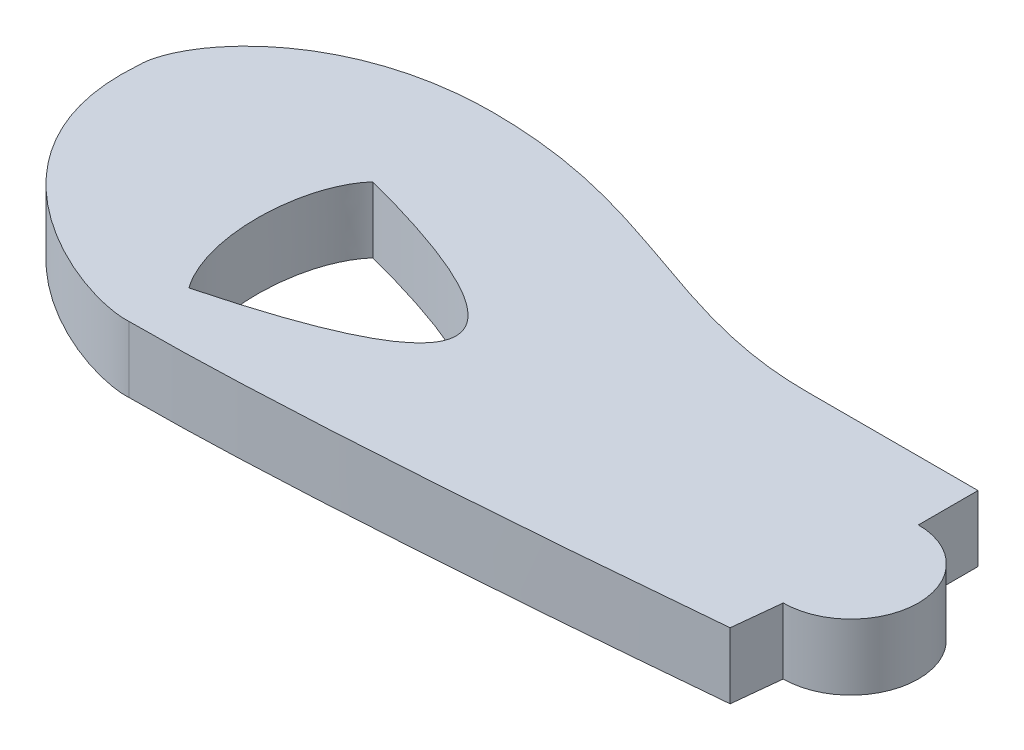
from build123d import *

# Parameters (mm, degrees)
BOSS_EXTRUDE1_DEPTH = 10
SKETCH5_W           = 190.665965361
SKETCH5_H           = 98.914857752
CUT_EXTRUDE2_DEPTH  = 131.512395512
CUT_EXTRUDE1_DEPTH  = 125.356356188


with BuildPart() as part:
    # Sketch2 → Boss-Extrude1 (new body)
    with BuildSketch(Plane(origin=(0, 0, 0), x_dir=(1, 0, 0), z_dir=(0, 1, 0))):
        with BuildLine():
            Line((-26, 24.3), (0, 24.3))
            add(Edge.make_bspline(
                [(0, 24.3), (20.683832289, 24.384713811), (29.8, 14.098961604), (29.8, 0)],
                knots=[0, 0, 0, 0, 1, 1, 1, 1], degree=3))
            add(Edge.make_bspline(
                [(29.8, 0), (29.8, -15.903385672), (12.793782652, -19.673675204), (0, -22.5)],
                knots=[0, 0, 0, 0, 1, 1, 1, 1], degree=3))
            add(Edge.make_bspline(
                [(-86.5, -27.9), (-58.742591927, -27.9), (0, -22.5)],
                knots=[0, 0, 0, 1, 1, 1], degree=2))
            add(Edge.make_bspline(
                [(-124.6, 11.6), (-126.645501882, -15.929564791), (-96.169164371, -28.458925346), (-86.5, -27.9)],
                knots=[0, 0, 0, 0, 1, 1, 1, 1], degree=3))
            add(Edge.make_bspline(
                [(-86.5, 37.2), (-111.583343569, 37.2), (-124.6, 21.145918181), (-124.6, 11.6)],
                knots=[0, 0, 0, 0, 1, 1, 1, 1], degree=3))
            add(Edge.make_bspline(
                [(-26, 24.3), (-46.37360759, 24.3), (-60.223367409, 37.2), (-86.5, 37.2)],
                knots=[0, 0, 0, 0, 1, 1, 1, 1], degree=3))
        make_face()
    extrude(amount=BOSS_EXTRUDE1_DEPTH)

    # Sketch5 → Cut-Extrude2 (cut, through all)
    with BuildSketch(Plane(origin=(0, 10, 0), x_dir=(1, 0, 0), z_dir=(0, 1, 0))):
        with Locations((-37.807166851, 5.712427693)):
            Rectangle(SKETCH5_W, SKETCH5_H)
        with BuildLine():
            Line((0, 19.3), (-26, 19.3))
            add(Edge.make_bspline(
                [(-26, 19.3), (-28.614389566, 19.3), (-31.195480065, 19.494126305), (-36.299918034, 20.219008193), (-38.823236595, 20.749932309), (-43.82844627, 22.053293526), (-46.31311575, 22.826190042), (-51.244397222, 24.470393512), (-53.69402913, 25.341112046), (-58.607069123, 27.040712597), (-61.070722849, 27.868848632), (-64.806301572, 28.989279687), (-66.059451522, 29.343006622), (-68.572193461, 29.996166113), (-69.832412317, 30.295833479), (-73.626302931, 31.102275727), (-76.173387066, 31.51524352), (-81.307214737, 32.063798503), (-83.893870441, 32.2), (-86.5, 32.2)],
                knots=[0, 0, 0, 0, 0.125, 0.125, 0.25, 0.25, 0.375, 0.375, 0.5, 0.5, 0.625, 0.625, 0.6875, 0.6875, 0.75, 0.75, 0.875, 0.875, 1, 1, 1, 1], degree=3))
            add(Edge.make_bspline(
                [(-86.5, 32.2), (-90.047671723, 32.2), (-93.539315109, 31.853363621), (-97.818101716, 30.88944061), (-98.669522164, 30.669824618), (-100.363040922, 30.17291839), (-101.207876089, 29.89460231), (-103.707194596, 28.9730152), (-105.314538731, 28.24898707), (-108.402461221, 26.564840966), (-109.885156962, 25.604040465), (-112.695415045, 23.412360835), (-113.989352092, 22.209304545), (-115.736354807, 20.217749989), (-116.286105675, 19.522480074), (-117.307591473, 18.056713662), (-117.771937921, 17.297113036), (-118.380597746, 16.112260348), (-118.568848857, 15.709499136), (-118.910400222, 14.885324985), (-119.063856456, 14.46298862), (-119.32099023, 13.612441675), (-119.425833719, 13.182501201), (-119.534502641, 12.528030347), (-119.56255262, 12.308265558), (-119.588853411, 11.975515189), (-119.594973106, 11.86407762), (-119.600932982, 11.639967141), (-119.6, 11.527142129), (-119.6, 11.414500659)],
                knots=[0, 0, 0, 0, 0.25, 0.25, 0.3125, 0.3125, 0.375, 0.375, 0.5, 0.5, 0.625, 0.625, 0.75, 0.75, 0.8125, 0.8125, 0.875, 0.875, 0.90625, 0.90625, 0.9375, 0.9375, 0.96875, 0.96875, 0.984375, 0.984375, 0.9921875, 0.9921875, 1, 1, 1, 1], degree=3))
            add(Edge.make_bspline(
                [(-119.6, 11.414500659), (-119.620469876, 11.139005048), (-119.640012507, 10.863585734), (-119.66949801, 10.313536999), (-119.702590259, 9.489380197), (-119.701746238, 8.668015761), (-119.653311171, 7.029133356), (-119.558725583, 5.941670929), (-119.316814989, 4.318708201), (-119.219497862, 3.779093122), (-118.990298597, 2.702707063), (-118.857842254, 2.164001324), (-118.411370332, 0.568296748), (-118.049576648, -0.466050211), (-117.204822005, -2.479103419), (-116.721870667, -3.457814087), (-115.911016092, -4.886192051), (-115.626316263, -5.355698602), (-115.028686616, -6.281748331), (-114.715117794, -6.739029825), (-113.098128241, -8.967198862), (-111.636582687, -10.586754888), (-109.243370012, -12.821144966), (-108.411754958, -13.533067597), (-107.116844881, -14.554870601), (-106.676456633, -14.888333255), (-105.787025552, -15.535321816), (-105.337421344, -15.84934205), (-103.066112758, -17.374312871), (-101.175798147, -18.452299517), (-98.237583629, -19.870168351), (-97.240844592, -20.309198302), (-95.209999189, -21.114841784), (-94.174615133, -21.48224539), (-92.064314636, -22.126795927), (-91.001033475, -22.402007075), (-89.387886633, -22.70933152), (-88.84713932, -22.794224632), (-88.028751145, -22.879499568), (-87.754740398, -22.90089357), (-87.340882626, -22.916536257), (-87.202453029, -22.918989427), (-86.924204685, -22.915854968), (-86.784006393, -22.908070411), (-86.64375233, -22.899963035)],
                knots=[0, 0, 0, 0, 0.015625, 0.015625, 0.03125, 0.0625, 0.0625, 0.125, 0.125, 0.15625, 0.15625, 0.1875, 0.1875, 0.25, 0.25, 0.3125, 0.3125, 0.34375, 0.34375, 0.375, 0.375, 0.5, 0.5, 0.5625, 0.5625, 0.59375, 0.59375, 0.625, 0.625, 0.75, 0.75, 0.8125, 0.8125, 0.875, 0.875, 0.9375, 0.9375, 0.96875, 0.96875, 0.984375, 0.984375, 0.9921875, 0.9921875, 1, 1, 1, 1], degree=3))
            add(Edge.make_bspline(
                [(-86.64375233, -22.899963035), (-83.051721737, -22.901813131), (-79.463866007, -22.836654879), (-72.292852573, -22.630933055), (-68.709770334, -22.489158228), (-57.965349536, -21.986375675), (-50.808741052, -21.549448214), (-36.50252062, -20.563295893), (-29.353030187, -20.012120654), (-15.058799553, -18.833526914), (-7.914092044, -18.205583695), (-0.771119947, -17.549786375)],
                knots=[0, 0, 0, 0, 0.125, 0.125, 0.25, 0.25, 0.5, 0.5, 0.75, 0.75, 1, 1, 1, 1], degree=3))
            add(Edge.make_bspline(
                [(-0.771119947, -17.549786375), (1.963321139, -16.94544861), (4.695341149, -16.33357579), (8.730024902, -15.218615637), (10.064478195, -14.814466089), (12.699729823, -13.90142355), (14.000796007, -13.393364173), (15.911888282, -12.505206219), (16.542091865, -12.187905528), (17.784402153, -11.496981701), (18.391917697, -11.125662576), (19.559410174, -10.32463286), (20.121164342, -9.894098151), (20.920538613, -9.18924898), (21.180682911, -8.943393186), (21.678462153, -8.434660622), (21.916135354, -8.171907904), (22.59259098, -7.356311131), (22.994745994, -6.776081028), (23.513123046, -5.842290056), (23.671822244, -5.519779327), (23.953566298, -4.86813842), (24.077688222, -4.537273262), (24.402854637, -3.53046254), (24.556745878, -2.840315617), (24.755950633, -1.42732092), (24.8, -0.714331591), (24.8, 0)],
                knots=[0, 0, 0, 0, 0.25, 0.25, 0.375, 0.375, 0.5, 0.5, 0.5625, 0.5625, 0.625, 0.625, 0.6875, 0.6875, 0.71875, 0.71875, 0.75, 0.75, 0.8125, 0.8125, 0.84375, 0.84375, 0.875, 0.875, 0.9375, 0.9375, 1, 1, 1, 1], degree=3))
            add(Edge.make_bspline(
                [(24.8, 0), (24.800001574, 1.499794527), (24.679867583, 2.978315628), (24.270262238, 5.1554747), (24.095205029, 5.874372955), (23.764785291, 6.940708409), (23.64330548, 7.294145508), (23.375491288, 7.996618496), (23.229208001, 8.345127218), (22.758435322, 9.365838107), (22.399931747, 10.019031745), (21.589242675, 11.268187742), (21.136243882, 11.865038785), (19.63468306, 13.559968632), (18.489202915, 14.513686307), (16.909680401, 15.525653475), (16.58535259, 15.719500417), (15.929822317, 16.085938782), (15.598164332, 16.258912353), (14.592578593, 16.74990385), (13.908081512, 17.040104299), (12.515293354, 17.557881638), (11.806985872, 17.785415353), (10.369782811, 18.186296846), (9.638661479, 18.360025682), (7.436633609, 18.806009812), (5.959001697, 19.004489088), (2.98950105, 19.255065786), (1.497532001, 19.3061318), (0, 19.3)],
                knots=[0, 0, 0, 0, 0.125, 0.125, 0.1875, 0.1875, 0.21875, 0.21875, 0.25, 0.25, 0.3125, 0.3125, 0.375, 0.375, 0.5, 0.5, 0.53125, 0.53125, 0.5625, 0.5625, 0.625, 0.625, 0.6875, 0.6875, 0.75, 0.75, 0.875, 0.875, 1, 1, 1, 1], degree=3))
        make_face(mode=Mode.SUBTRACT)
    extrude(amount=-CUT_EXTRUDE2_DEPTH, mode=Mode.SUBTRACT)

    # Sketch3 → Cut-Extrude1 (cut, through all)
    with BuildSketch(Plane(origin=(0, 10, 0), x_dir=(1, 0, 0), z_dir=(0, 1, 0))):
        with BuildLine():
            Line((0, 19.3), (0, 10.258653745))
            ThreePointArc((0, 10.258653745), (10.258653745, 0), (0, -10.258653745))
            Line((0, -10.258653745), (-0.771119947, -17.549786375))
            add(Edge.make_bspline(
                [(-0.771119947, -17.549786375), (1.963321139, -16.94544861), (4.695341149, -16.33357579), (8.730024902, -15.218615637), (10.064478195, -14.814466089), (12.699729823, -13.90142355), (14.000796007, -13.393364173), (15.911888282, -12.505206219), (16.542091865, -12.187905528), (17.784402153, -11.496981701), (18.391917697, -11.125662576), (19.559410174, -10.32463286), (20.121164342, -9.894098151), (20.920538613, -9.18924898), (21.180682911, -8.943393186), (21.678462153, -8.434660622), (21.916135354, -8.171907904), (22.59259098, -7.356311131), (22.994745994, -6.776081028), (23.513123046, -5.842290056), (23.671822244, -5.519779327), (23.953566298, -4.86813842), (24.077688222, -4.537273262), (24.402854637, -3.53046254), (24.556745878, -2.840315617), (24.755950633, -1.42732092), (24.8, -0.714331591), (24.8, 0)],
                knots=[0, 0, 0, 0, 0.25, 0.25, 0.375, 0.375, 0.5, 0.5, 0.5625, 0.5625, 0.625, 0.625, 0.6875, 0.6875, 0.71875, 0.71875, 0.75, 0.75, 0.8125, 0.8125, 0.84375, 0.84375, 0.875, 0.875, 0.9375, 0.9375, 1, 1, 1, 1], degree=3))
            add(Edge.make_bspline(
                [(24.8, 0), (24.800001574, 1.499794527), (24.679867583, 2.978315628), (24.270262238, 5.1554747), (24.095205029, 5.874372955), (23.764785291, 6.940708409), (23.64330548, 7.294145508), (23.375491288, 7.996618496), (23.229208001, 8.345127218), (22.758435322, 9.365838107), (22.399931747, 10.019031745), (21.589242675, 11.268187742), (21.136243882, 11.865038785), (19.63468306, 13.559968632), (18.489202915, 14.513686307), (16.909680401, 15.525653475), (16.58535259, 15.719500417), (15.929822317, 16.085938782), (15.598164332, 16.258912353), (14.592578593, 16.74990385), (13.908081512, 17.040104299), (12.515293354, 17.557881638), (11.806985872, 17.785415353), (10.369782811, 18.186296846), (9.638661479, 18.360025682), (7.436633609, 18.806009812), (5.959001697, 19.004489088), (2.98950105, 19.255065786), (1.497532001, 19.3061318), (0, 19.3)],
                knots=[0, 0, 0, 0, 0.125, 0.125, 0.1875, 0.1875, 0.21875, 0.21875, 0.25, 0.25, 0.3125, 0.3125, 0.375, 0.375, 0.5, 0.5, 0.53125, 0.53125, 0.5625, 0.5625, 0.625, 0.625, 0.6875, 0.6875, 0.75, 0.75, 0.875, 0.875, 1, 1, 1, 1], degree=3))
        make_face()
        with BuildLine():
            add(Edge.make_bspline(
                [(-86.5, -13.95), (-91.961767729, -6.422776523), (-91.717468637, 8.040517078), (-86.5, 13.95)],
                knots=[0, 0, 0, 0, 1, 1, 1, 1], degree=3))
            add(Edge.make_bspline(
                [(-86.5, 13.95), (-33.347412006, 0), (-86.5, -13.95)],
                knots=[0, 0, 0, 1, 1, 1], degree=2))
        make_face()
    extrude(amount=-CUT_EXTRUDE1_DEPTH, mode=Mode.SUBTRACT)


solid = part.part
